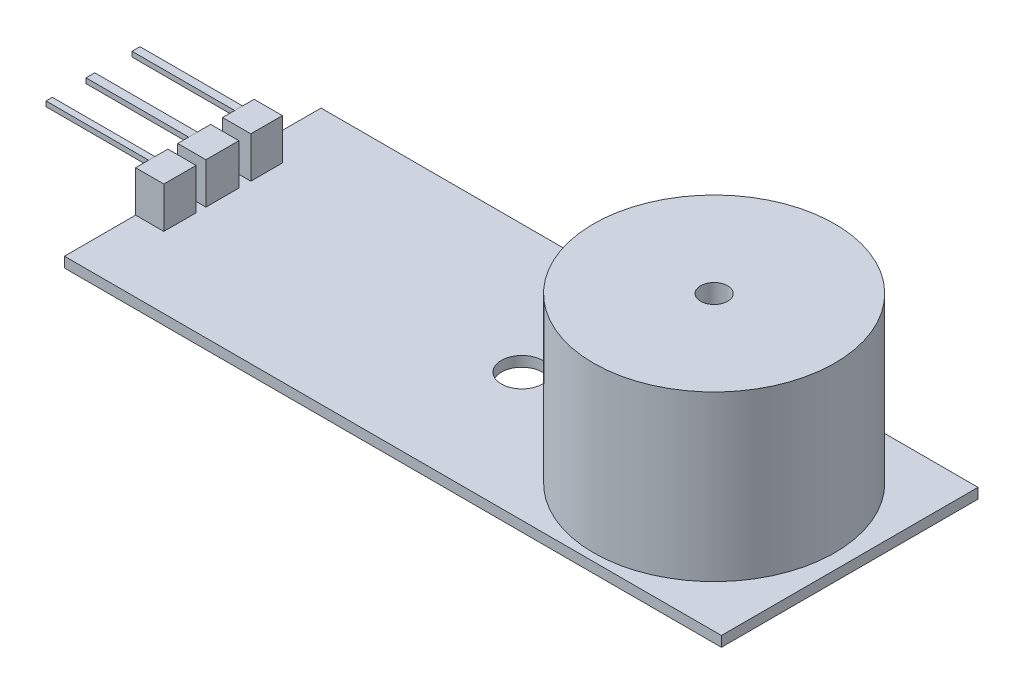
from build123d import *

# Parameters (mm, degrees)
SKETCH1_W             = 32
SKETCH1_H             = 12.5
BOSS_EXTRUDE1_DEPTH   = 0.5
SKETCH2_R             = 5.877168317
BOSS_EXTRUDE3_DEPTH   = 8
SKETCH4_R             = 1
CUT_EXTRUDE1_DEPTH    = 8
SKETCH5_W             = 1.375418373
SKETCH5_H             = 1.605970413
BOSS_EXTRUDE4_DEPTH   = 2
SKETCH5_H_2           = 1.537631246
BOSS_EXTRUDE4_2_DEPTH = 2
SKETCH5_H_3           = 1.571800829
BOSS_EXTRUDE4_3_DEPTH = 2
SKETCH6_W             = 0.387077311
SKETCH6_H             = 0.245450271
BOSS_EXTRUDE5_DEPTH   = 5
SKETCH6_W_2           = 0.427119791
BOSS_EXTRUDE5_2_DEPTH = 5
SKETCH6_W_3           = 0.306992349
BOSS_EXTRUDE5_3_DEPTH = 5
SKETCH7_R             = 0.658510197
CUT_EXTRUDE2_DEPTH    = 5


with BuildPart() as part:
    # Sketch1 → Boss-Extrude1 (new body)
    with BuildSketch(Plane(origin=(0, 0, 0), x_dir=(1, 0, 0), z_dir=(0, 1, 0))):
        with Locations((16, 6.25)):
            Rectangle(SKETCH1_W, SKETCH1_H)
    extrude(amount=BOSS_EXTRUDE1_DEPTH)

    # Sketch4 → Cut-Extrude1 (cut)
    with BuildSketch(Plane(origin=(0, 0.5, 0), x_dir=(1, 0, 0), z_dir=(0, 1, 0))):
        with Locations(Location((16.034169583, 6.25, 0), (0, 0, 270))):
            Circle(SKETCH4_R)
    extrude(amount=-CUT_EXTRUDE1_DEPTH, mode=Mode.SUBTRACT)


with BuildPart() as body_2:
    # Sketch2 → Boss-Extrude3 (new body)
    with BuildSketch(Plane(origin=(0, 0.5, 0), x_dir=(1, 0, 0), z_dir=(0, 1, 0))):
        with Locations(Location((25.396635391, 6.25, 0), (0, 0, 270))):
            Circle(SKETCH2_R)
    extrude(amount=BOSS_EXTRUDE3_DEPTH)

    # Sketch7 → Cut-Extrude2 (cut)
    with BuildSketch(Plane(origin=(0, 8.5, 0), x_dir=(1, 0, 0), z_dir=(0, 1, 0))):
        with Locations(Location((25.396635391, 6.25, 0), (0, 0, 270))):
            Circle(SKETCH7_R)
    extrude(amount=-CUT_EXTRUDE2_DEPTH, mode=Mode.SUBTRACT)


with BuildPart() as body_3:
    # Sketch5 → Boss-Extrude4 (new body)
    with BuildSketch(Plane(origin=(0, 0.5, 0), x_dir=(1, 0, 0), z_dir=(0, 1, 0))):
        with Locations((0.687709187, 6.318339167)):
            Rectangle(SKETCH5_W, SKETCH5_H)
    extrude(amount=BOSS_EXTRUDE4_DEPTH)


with BuildPart() as body_4:
    # Sketch5 → Boss-Extrude4 2 (new body)
    with BuildSketch(Plane(origin=(0, 0.5, 0), x_dir=(1, 0, 0), z_dir=(0, 1, 0))):
        with Locations((0.687709187, 8.471022911)):
            Rectangle(SKETCH5_W, SKETCH5_H_2)
    extrude(amount=BOSS_EXTRUDE4_2_DEPTH)


with BuildPart() as body_5:
    # Sketch5 → Boss-Extrude4 3 (new body)
    with BuildSketch(Plane(origin=(0, 0.5, 0), x_dir=(1, 0, 0), z_dir=(0, 1, 0))):
        with Locations((0.687709187, 4.251079381)):
            Rectangle(SKETCH5_W, SKETCH5_H_3)
    extrude(amount=BOSS_EXTRUDE4_3_DEPTH)


with BuildPart() as body_6:
    # Sketch6 → Boss-Extrude5 (new body)
    with BuildSketch(Plane.ZY):
        with Locations((-8.485705153, 2.377274865)):
            Rectangle(SKETCH6_W, SKETCH6_H)
    extrude(amount=BOSS_EXTRUDE5_DEPTH)


with BuildPart() as body_7:
    # Sketch6 → Boss-Extrude5 2 (new body)
    with BuildSketch(Plane.ZY):
        with Locations((-6.263347493, 2.377274865)):
            Rectangle(SKETCH6_W_2, SKETCH6_H)
    extrude(amount=BOSS_EXTRUDE5_2_DEPTH)


with BuildPart() as body_8:
    # Sketch6 → Boss-Extrude5 3 (new body)
    with BuildSketch(Plane.ZY):
        with Locations((-4.254549729, 2.377274865)):
            Rectangle(SKETCH6_W_3, SKETCH6_H)
    extrude(amount=BOSS_EXTRUDE5_3_DEPTH)


solid = Compound([part.part, body_2.part, body_3.part, body_4.part, body_5.part, body_6.part, body_7.part, body_8.part])
